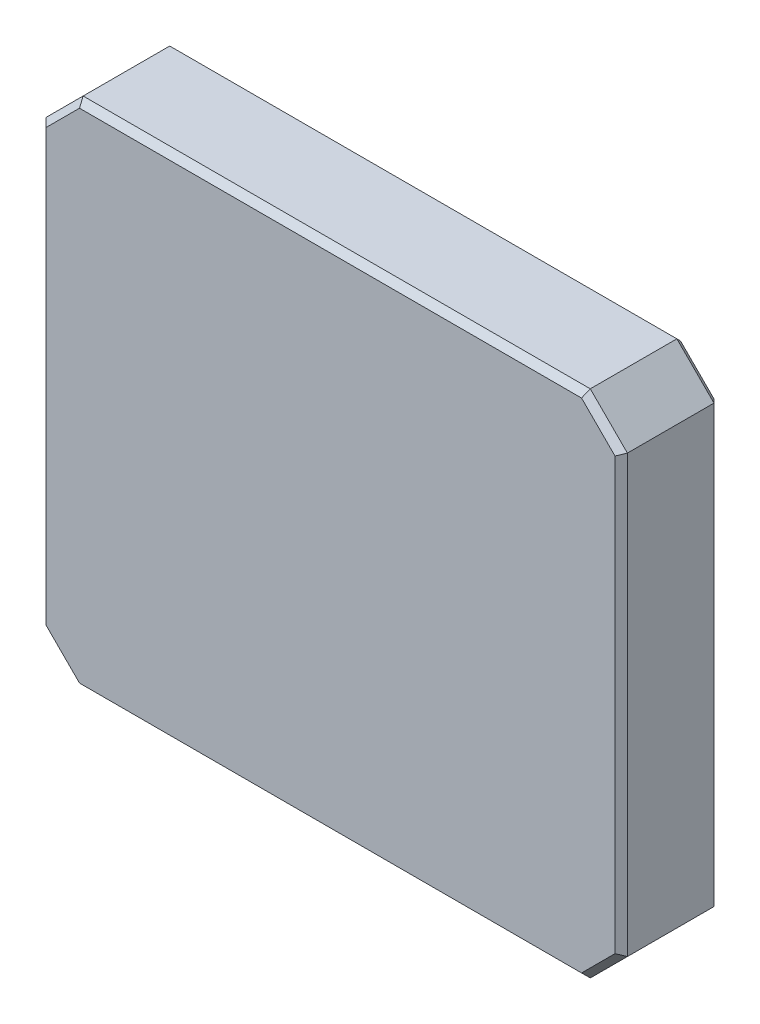
from build123d import *

# Parameters (mm, degrees)
BOSS_EXTRUDE1_DEPTH = 16
CHAMFER1_SIZE       = 1


with BuildPart() as part:
    # Sketch1 → Boss-Extrude1 (new body)
    with BuildSketch(Plane.XY):
        Polygon((-47, 35.25), (-41, 41.25), (41, 41.25), (47, 35.25), (47, -35.25), (41, -41.25), (-41, -41.25), (-47, -35.25), align=None)
    extrude(amount=BOSS_EXTRUDE1_DEPTH)

    # Chamfer1
    chamfer1_edges = [part.edges().sort_by_distance(p)[0] for p in [
        (44, -38.25, 0),
        (0, -41.25, 0),
        (-44, -38.25, 0),
        (-47, 0, 0),
        (0, -41.25, 16),
        (44, -38.25, 16),
        (47, 0, 16),
        (44, 38.25, 16),
        (0, 41.25, 16),
        (-44, 38.25, 16),
        (-47, 0, 16),
        (-44, 38.25, 0),
        (-44, -38.25, 16),
        (0, 41.25, 0),
        (44, 38.25, 0),
        (47, 0, 0),
    ]]
    chamfer(chamfer1_edges, length=CHAMFER1_SIZE)


solid = part.part
